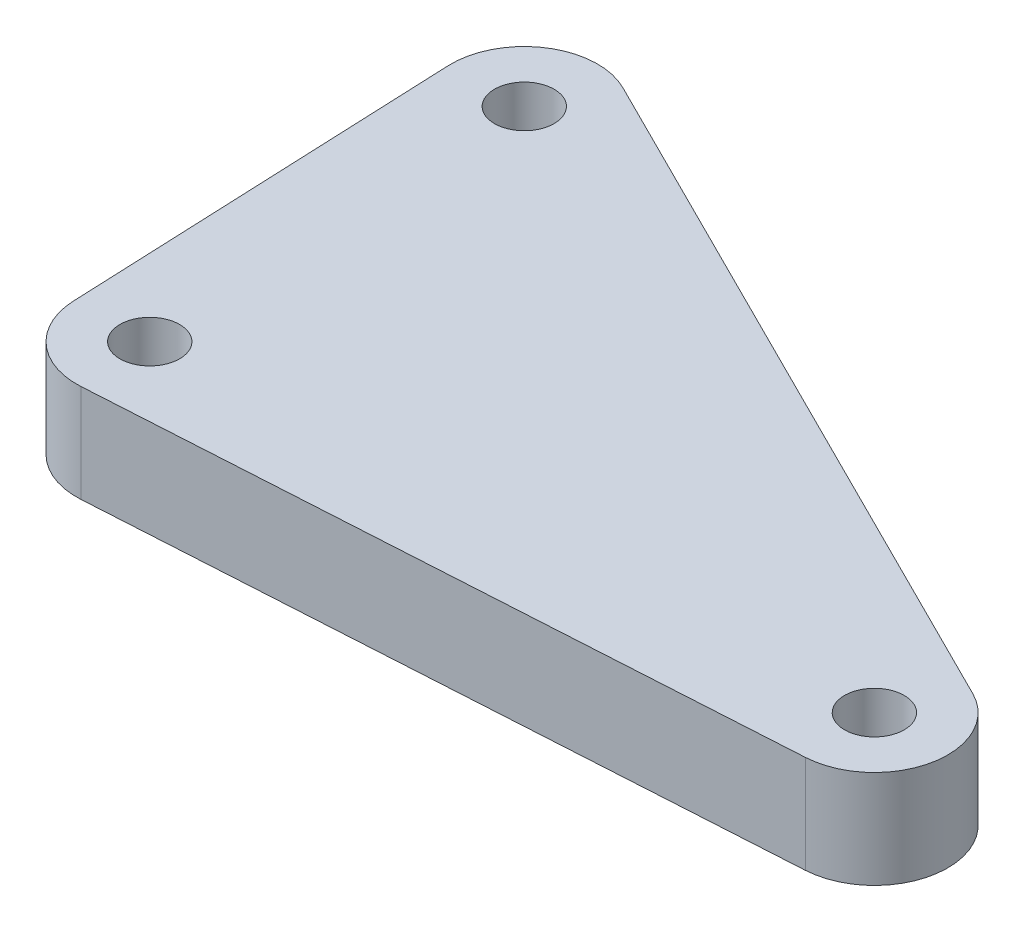
from build123d import *

# Parameters (mm, degrees)
SKETCH1_R           = 3.05
BOSS_EXTRUDE1_DEPTH = 10


with BuildPart() as part:
    # Sketch1 → Boss-Extrude1 (new body)
    with BuildSketch(Plane(origin=(0, 0, 0), x_dir=(1, 0, 0), z_dir=(0, 1, 0))):
        with BuildLine():
            Line((3.353619366, 6.708445211), (-68.203129549, 42.480385117))
            ThreePointArc((-68.203129549, 42.480385117), (-75.633286622, 42.067322367), (-79.050111893, 35.456485806))
            Line((-79.050111893, 35.456485806), (-77.367690022, -4.50811674))
            ThreePointArc((-77.367690022, -4.50811674), (-74.900370188, -9.759429234), (-69.425113191, -11.67919768))
            Line((-69.425113191, -11.67919768), (0.449213854, -7.486535041))
            ThreePointArc((0.449213854, -7.486535041), (7.347771853, -1.503412382), (3.353619366, 6.708445211))
        make_face()
        with Locations(Location((-71.556748915, 35.771939906, 0), (0, 0, 270))):
            Circle(SKETCH1_R, mode=Mode.SUBTRACT)
        with Locations(Location((-69.874327045, -4.19266264, 0), (0, 0, 270))):
            Circle(SKETCH1_R, mode=Mode.SUBTRACT)
        with Locations(Location((0, 0, 0), (0, 0, 270))):
            Circle(SKETCH1_R, mode=Mode.SUBTRACT)
    extrude(amount=BOSS_EXTRUDE1_DEPTH)


solid = part.part
